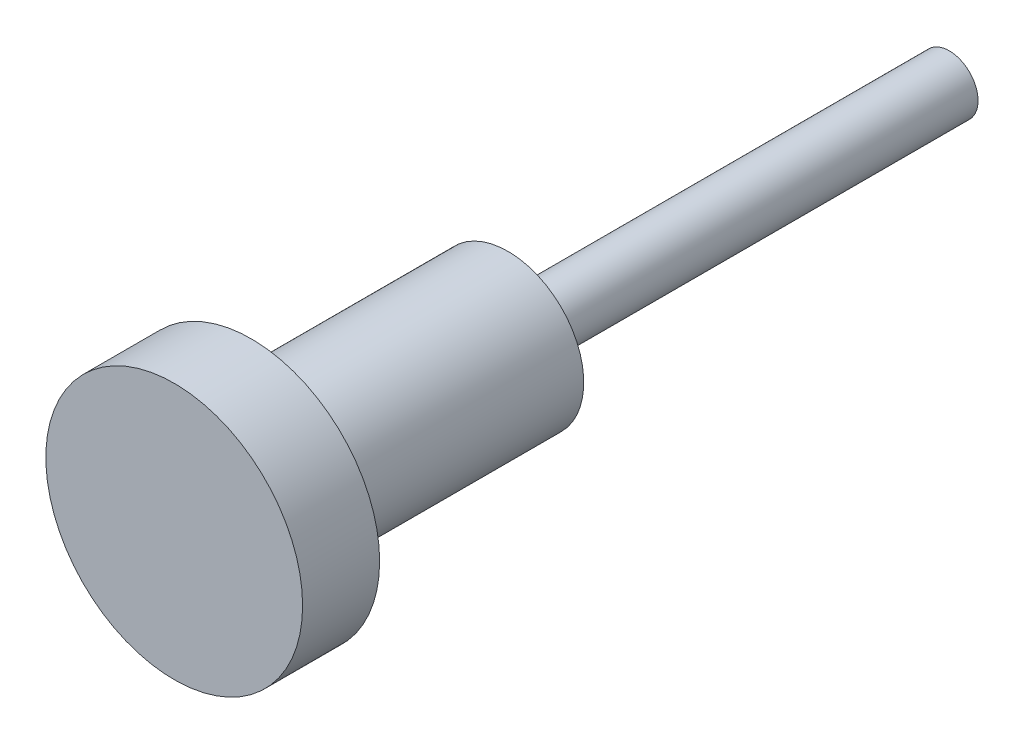
from build123d import *

# Parameters (mm, degrees)
SKETCH_1_R      = 5
EXTRUDE_1_DEPTH = 3
SKETCH_2_R      = 2.948811386
EXTRUDE_2_DEPTH = 10
SKETCH_3_R      = 1.122261049
EXTRUDE_3_DEPTH = 17.182541617


with BuildPart() as part:
    # 草图1 → 凸台-拉伸1 (new body)
    with BuildSketch(Plane.XY):
        Circle(SKETCH_1_R)
    extrude(amount=EXTRUDE_1_DEPTH)

    # 草图2 → 凸台-拉伸2 (add)
    with BuildSketch(Plane(origin=(0, 0, 0), x_dir=(-1, 0, 0), z_dir=(0, 0, -1))):
        Circle(SKETCH_2_R)
    extrude(amount=EXTRUDE_2_DEPTH)

    # 草图3 → 凸台-拉伸3 (add)
    with BuildSketch(Plane(origin=(0, 0, -10), x_dir=(-1, 0, 0), z_dir=(0, 0, -1))):
        Circle(SKETCH_3_R)
    extrude(amount=EXTRUDE_3_DEPTH)


solid = part.part
